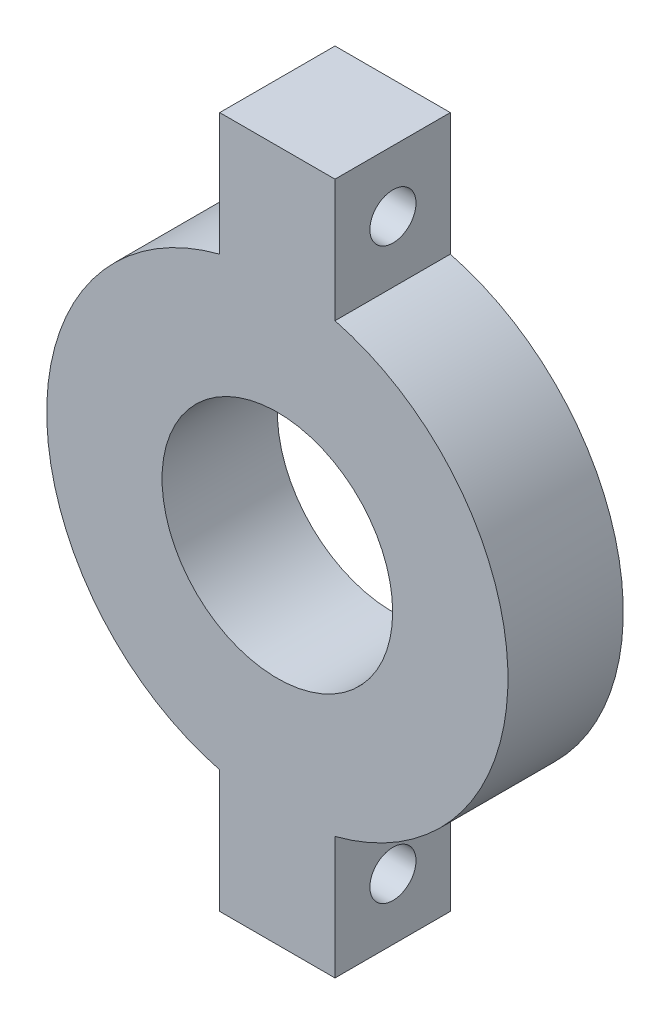
from build123d import *

# Parameters (mm, degrees)
ESQUISSE1_R             = 10
ESQUISSE1_R_2           = 5
BOSS_EXTRU_1_DEPTH      = 5
ESQUISSE2_W             = 5
ESQUISSE2_H             = 7
BOSS_EXTRU_2_DEPTH      = 5
ESQUISSE3_R             = 1
ENL_V_MAT_EXTRU_1_DEPTH = 10


with BuildPart() as part:
    # Esquisse1 → Boss.-Extru.1 (new body)
    with BuildSketch(Plane.XY):
        Circle(ESQUISSE1_R)
        Circle(ESQUISSE1_R_2, mode=Mode.SUBTRACT)
    extrude(amount=BOSS_EXTRU_1_DEPTH)

    # Esquisse2 → Boss.-Extru.2 (add)
    with BuildSketch(Plane.XY.offset(5)):
        with Locations((0, 11.5)):
            Rectangle(ESQUISSE2_W, ESQUISSE2_H)
    boss_extru_2 = extrude(amount=-BOSS_EXTRU_2_DEPTH)

    # Esquisse3 → Enlèv. mat.-Extru.1 (cut)
    with BuildSketch(Plane(origin=(-2.5, 0, 0), x_dir=(0, -1, 0), z_dir=(-1, 0, 0))):
        with Locations((-12.345891544, 2.487364075)):
            Circle(ESQUISSE3_R)
    enl_v_mat_extru_1 = extrude(amount=-ENL_V_MAT_EXTRU_1_DEPTH, mode=Mode.SUBTRACT)

    # Symétrie1: Boss.-Extru.2, Enlèv. mat.-Extru.1 across plane
    add(boss_extru_2.mirror(Plane.ZX))
    add(enl_v_mat_extru_1.mirror(Plane.ZX), mode=Mode.SUBTRACT)


solid = part.part
